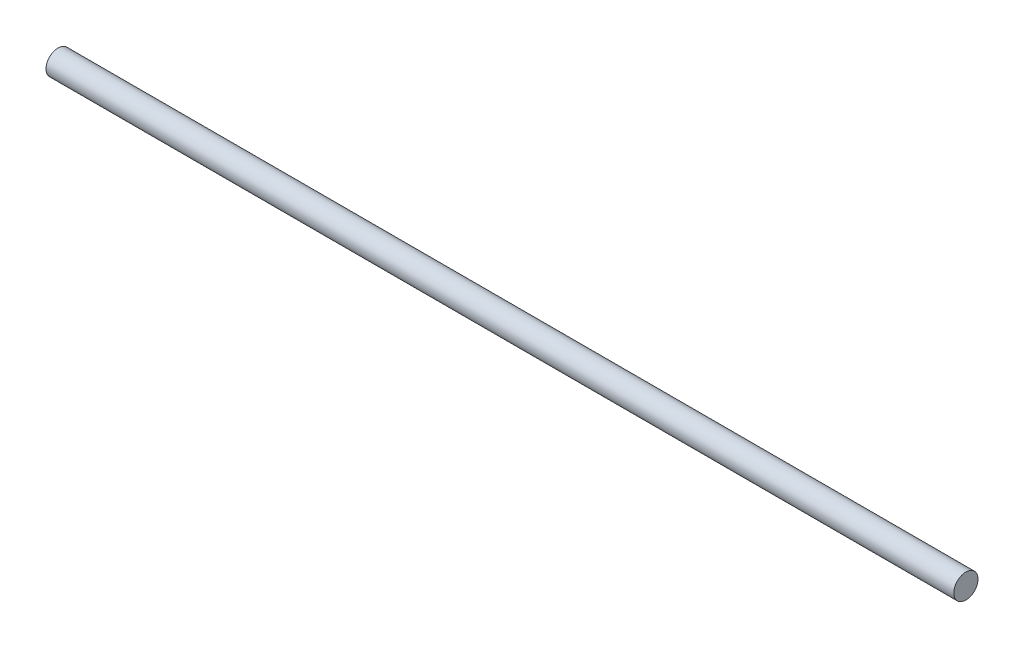
from build123d import *

# Parameters (mm, degrees)
SKETCH1_R           = 6.35
BOSS_EXTRUDE1_DEPTH = 474.8


with BuildPart() as part:
    # Sketch1 → Boss-Extrude1 (new body)
    with BuildSketch(Plane(origin=(0, 0, 0), x_dir=(0, 0, -1), z_dir=(1, 0, 0))):
        with Locations(Location((0, 0, 0), (0, 0, 180))):
            Circle(SKETCH1_R)
    extrude(amount=BOSS_EXTRUDE1_DEPTH)


solid = part.part
